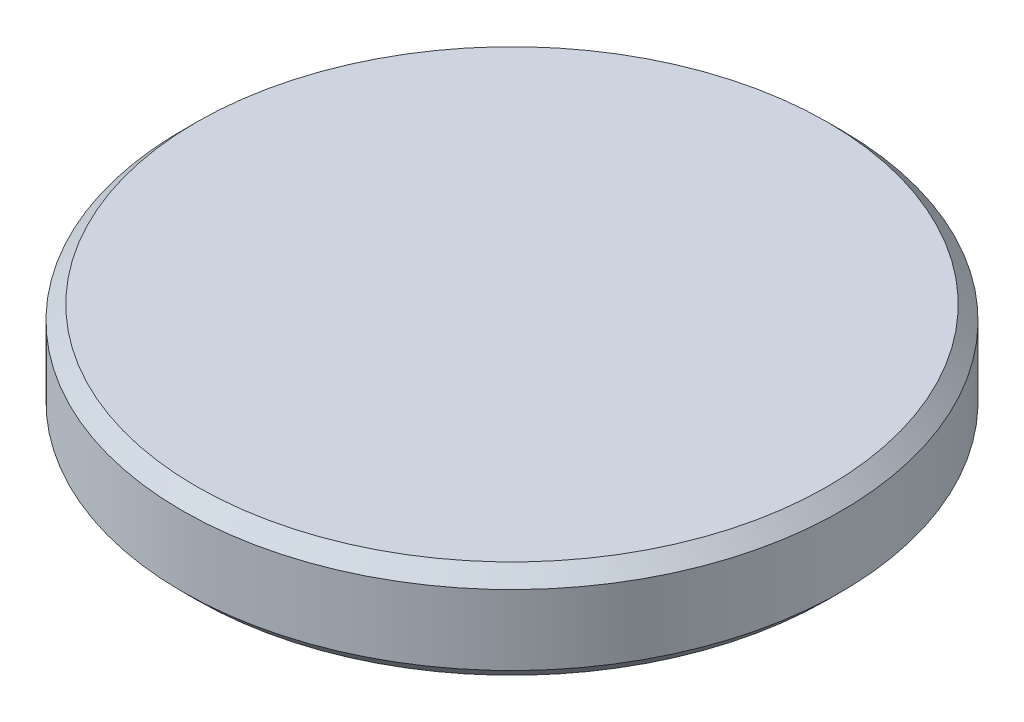
from build123d import *

# Parameters (mm, degrees)
SKETCH_1_R        = 3.525
EXTRUDE_225_DEPTH = 1.05
CHAMFER_1_SIZE    = 0.15


with BuildPart() as part:
    # Эскиз1 → Extrude 225 (new body)
    with BuildSketch(Plane(origin=(0, 0, 0), x_dir=(1, 0, 0), z_dir=(0, 1, 0))):
        with Locations(Location((0, 0, 0), (0, 0, 270))):
            Circle(SKETCH_1_R)
    extrude(amount=EXTRUDE_225_DEPTH)

    # Фаска1
    chamfer_1_edges = [part.edges().sort_by_distance(p)[0] for p in [
        (0, 0, -3.525),
        (0, 1.05, -3.525),
    ]]
    chamfer(chamfer_1_edges, length=CHAMFER_1_SIZE)


solid = part.part
